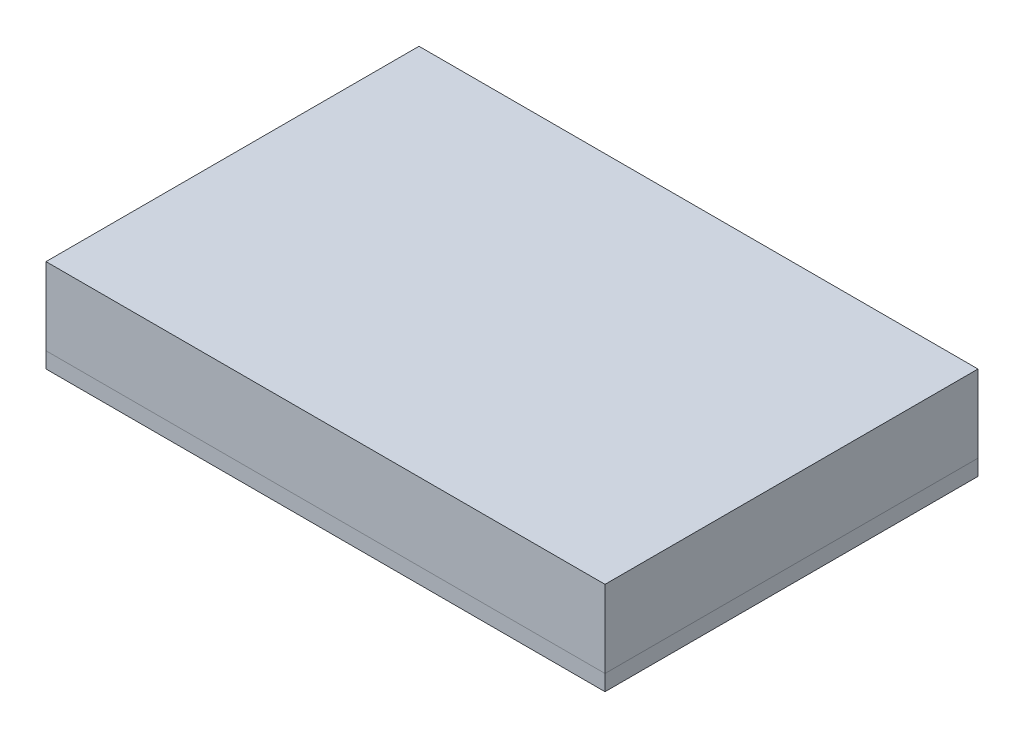
from build123d import *

# Parameters (mm, degrees)
SKETCH1_W           = 60.1
SKETCH1_H           = 40.1
BOSS_EXTRUDE1_DEPTH = 1.7
BOSS_EXTRUDE2_START = 1.7
SKETCH1_2_W         = 60.1
SKETCH1_2_H         = 40.1
BOSS_EXTRUDE2_DEPTH = 8.3


with BuildPart() as part:
    # Sketch1 → Boss-Extrude1 (new body)
    with BuildSketch(Plane(origin=(0, 0, 0), x_dir=(1, 0, 0), z_dir=(0, 1, 0))):
        with Locations((30.05, 20.05)):
            Rectangle(SKETCH1_W, SKETCH1_H)
    extrude(amount=BOSS_EXTRUDE1_DEPTH)


with BuildPart() as body_2:
    # Sketch1<2> → Boss-Extrude2 (new body)
    with BuildSketch(Plane(origin=(0, 0, 0), x_dir=(1, 0, 0), z_dir=(0, 1, 0)).offset(BOSS_EXTRUDE2_START)):
        with Locations((30.05, 20.05)):
            Rectangle(SKETCH1_2_W, SKETCH1_2_H)
    extrude(amount=BOSS_EXTRUDE2_DEPTH)


solid = Compound([part.part, body_2.part])
